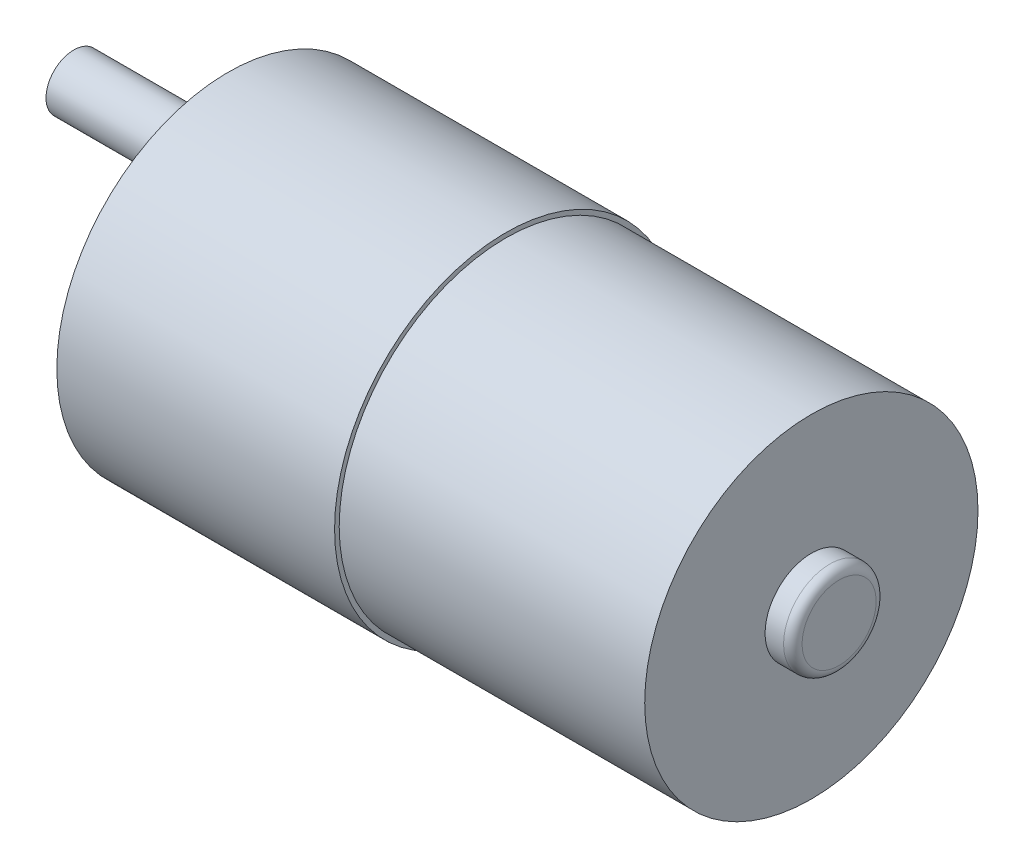
from build123d import *

# Parameters (mm, degrees)
SKETCH_1_W          = 33
SKETCH_1_H          = 18
SKETCH_2_W          = 14
SKETCH_2_H          = 3
SKETCH_2_W_2        = 2.671402587
SKETCH_2_H_2        = 6
CUT_EXTRUDE_START   = -30
SKETCH_4_R          = 1.5
CUT_EXTRUDE_1_DEPTH = 1


with BuildPart() as part:
    # 草图1 → 旋转1 (revolve)
    with BuildSketch(Plane.XY, mode=Mode.PRIVATE) as revolve_1_sk:
        Polygon((0, 18.5), (0, 18), (0, 0), (-30, 0), (-30, 18.5), align=None)
        with Locations((16.5, 9)):
            Rectangle(SKETCH_1_W, SKETCH_1_H)
        with BuildLine():
            Line((33, 5), (33, 0))
            Line((33, 0), (36, 0))
            Line((36, 0), (36, 4))
            ThreePointArc((36, 4), (35.707106781, 4.707106781), (35, 5))
            Line((35, 5), (33, 5))
        make_face()
    revolve(revolve_1_sk.sketch.rotate(Axis((-39.714285714, 0, 0), (1, 0, 0)), 90), axis=Axis((-39.714285714, 0, 0), (1, 0, 0)))

    # 草图2 → 旋转3 (revolve)
    with BuildSketch(Plane.XY, mode=Mode.PRIVATE) as revolve_3_sk:
        with Locations((-39.671402587, 10.75)):
            Rectangle(SKETCH_2_W, SKETCH_2_H)
        with Locations((-31.335701294, 12.25)):
            Rectangle(SKETCH_2_W_2, SKETCH_2_H_2)
    revolve(revolve_3_sk.sketch.rotate(Axis((-54.775263054, 9.25, 0), (1, 0, 0)), 180), axis=Axis((-54.775263054, 9.25, 0), (1, 0, 0)))

    # 草图4 → 切除-拉伸1 (cut)
    with BuildSketch(Plane(origin=(0, 0, 0), x_dir=(0, 0, -1), z_dir=(1, 0, 0)).offset(CUT_EXTRUDE_START)):
        with Locations((8, 0.25)):
            Circle(SKETCH_4_R)
        with Locations((-8, 0.25)):
            Circle(SKETCH_4_R)
    extrude(amount=CUT_EXTRUDE_1_DEPTH, mode=Mode.SUBTRACT)


solid = part.part
